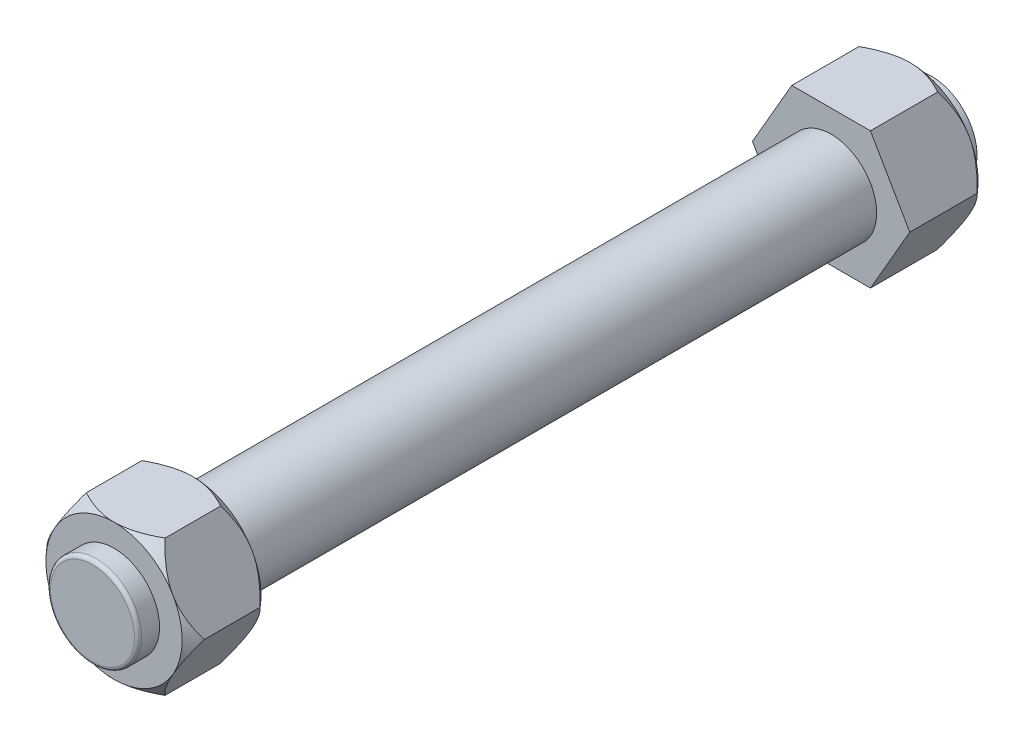
from build123d import *

# Parameters (mm, degrees)
CROQUIS1_R              = 6.35
SALIENTE_EXTRUIR1_DEPTH = 117
CROQUIS2_R              = 6.35
SALIENTE_EXTRUIR2_DEPTH = 14
CROQUIS3_R              = 6.35
CORTAR_EXTRUIR1_DEPTH   = 3
CROQUIS4_R              = 25.644678888
CROQUIS4_R_2            = 9.5
CORTAR_EXTRUIR2_DEPTH   = 10
CORTAR_EXTRUIR2_DRAFT   = -42
CROQUIS5_R              = 21.393004687
CROQUIS5_R_2            = 9.5
CORTAR_EXTRUIR3_DEPTH   = 10
CORTAR_EXTRUIR3_DRAFT   = -42
SALIENTE_EXTRUIR3_DEPTH = 14
CORTAR_EXTRUIR4_START   = -3
CROQUIS7_R              = 6.35
CORTAR_EXTRUIR4_DEPTH   = 3
CROQUIS9_R              = 21.176137587
CROQUIS9_R_2            = 9.5
CORTAR_EXTRUIR5_DEPTH   = 3
CORTAR_EXTRUIR5_DRAFT   = -42
REDONDEO1_R             = 0.5


with BuildPart() as part:
    # Croquis1 → Saliente-Extruir1 (new body)
    with BuildSketch(Plane.XY):
        Circle(CROQUIS1_R)
    extrude(amount=-SALIENTE_EXTRUIR1_DEPTH)

    # Croquis2 → Saliente-Extruir2 (add)
    with BuildSketch(Plane.XY):
        Polygon((10.969655115, 0), (5.484827557, 9.5), (-5.484827557, 9.5), (-10.969655115, 0), (-5.484827557, -9.5), (5.484827557, -9.5), align=None)
        Circle(CROQUIS2_R, mode=Mode.SUBTRACT)
    extrude(amount=-SALIENTE_EXTRUIR2_DEPTH)

    # Croquis3 → Cortar-Extruir1 (cut)
    with BuildSketch(Plane.XY):
        Polygon((10.969655115, 0), (5.484827557, 9.5), (-5.484827557, 9.5), (-10.969655115, 0), (-5.484827557, -9.5), (5.484827557, -9.5), align=None)
        Circle(CROQUIS3_R, mode=Mode.SUBTRACT)
    extrude(amount=-CORTAR_EXTRUIR1_DEPTH, mode=Mode.SUBTRACT)


with BuildPart() as cortar_extruir2_tool:
    # Croquis4 → Cortar-Extruir2 (with draft: the straight prism first)
    with BuildSketch(Plane.XY.offset(-3)):
        Circle(CROQUIS4_R)
        Circle(CROQUIS4_R_2, mode=Mode.SUBTRACT)
    extrude(amount=-CORTAR_EXTRUIR2_DEPTH)
    # Cortar-Extruir2: the draft: its side faces are tilted about the plane it starts from
    cortar_extruir2_sides = [cortar_extruir2_tool.faces().sort_by_distance(p)[0] for p in [
        (-25.644678888, 0, -8),
        (-9.5, 0, -8),
    ]]
    draft(cortar_extruir2_sides, Plane.XY.offset(-3), CORTAR_EXTRUIR2_DRAFT)


with BuildPart() as part_1:
    add(part.part)

    # Cortar-Extruir2: cut by cortar_extruir2_tool
    add(cortar_extruir2_tool.part, mode=Mode.SUBTRACT)


with BuildPart() as cortar_extruir3_tool:
    # Croquis5 → Cortar-Extruir3 (with draft: the straight prism first)
    with BuildSketch(Plane(origin=(0, 0, -14), x_dir=(-1, 0, 0), z_dir=(0, 0, -1))):
        Circle(CROQUIS5_R)
        Circle(CROQUIS5_R_2, mode=Mode.SUBTRACT)
    extrude(amount=-CORTAR_EXTRUIR3_DEPTH)
    # Cortar-Extruir3: the draft: its side faces are tilted about the plane it starts from
    cortar_extruir3_sides = [cortar_extruir3_tool.faces().sort_by_distance(p)[0] for p in [
        (21.393004687, 0, -9),
        (9.5, 0, -9),
    ]]
    draft(cortar_extruir3_sides, Plane(origin=(0, 0, -14), x_dir=(-1, 0, 0), z_dir=(0, 0, -1)), CORTAR_EXTRUIR3_DRAFT)


with BuildPart() as part_2:
    add(part_1.part)

    # Cortar-Extruir3: cut by cortar_extruir3_tool
    add(cortar_extruir3_tool.part, mode=Mode.SUBTRACT)

    # Croquis6 → Saliente-Extruir3 (add)
    with BuildSketch(Plane(origin=(0, 0, -117), x_dir=(-1, 0, 0), z_dir=(0, 0, -1))):
        Polygon((10.969655115, 0), (5.484827557, 9.5), (-5.484827557, 9.5), (-10.969655115, 0), (-5.484827557, -9.5), (5.484827557, -9.5), align=None)
    extrude(amount=-SALIENTE_EXTRUIR3_DEPTH)

    # Croquis7 → Cortar-Extruir4 (cut)
    with BuildSketch(Plane(origin=(0, 0, -117), x_dir=(-1, 0, 0), z_dir=(0, 0, -1)).offset(CORTAR_EXTRUIR4_START)):
        Polygon((10.969655115, 0), (5.484827557, 9.5), (-5.484827557, 9.5), (-10.969655115, 0), (-5.484827557, -9.5), (5.484827557, -9.5), align=None)
        with Locations(Location((0, 0, 0), (0, 0, 180))):
            Circle(CROQUIS7_R, mode=Mode.SUBTRACT)
    extrude(amount=CORTAR_EXTRUIR4_DEPTH, mode=Mode.SUBTRACT)


with BuildPart() as cortar_extruir5_tool:
    # Croquis9 → Cortar-Extruir5 (with draft: the straight prism first)
    with BuildSketch(Plane(origin=(0, 0, -114), x_dir=(-1, 0, 0), z_dir=(0, 0, -1))):
        Circle(CROQUIS9_R)
        Circle(CROQUIS9_R_2, mode=Mode.SUBTRACT)
    extrude(amount=-CORTAR_EXTRUIR5_DEPTH)
    # Cortar-Extruir5: the draft: its side faces are tilted about the plane it starts from
    cortar_extruir5_sides = [cortar_extruir5_tool.faces().sort_by_distance(p)[0] for p in [
        (21.176137587, 0, -112.5),
        (9.5, 0, -112.5),
    ]]
    draft(cortar_extruir5_sides, Plane(origin=(0, 0, -114), x_dir=(-1, 0, 0), z_dir=(0, 0, -1)), CORTAR_EXTRUIR5_DRAFT)


with BuildPart() as part_3:
    add(part_2.part)

    # Cortar-Extruir5: cut by cortar_extruir5_tool
    add(cortar_extruir5_tool.part, mode=Mode.SUBTRACT)

    # Redondeo1
    redondeo1_edges = [part_3.edges().sort_by_distance(p)[0] for p in [
        (-6.35, 0, 0),
    ]]
    fillet(redondeo1_edges, radius=REDONDEO1_R)


solid = part_3.part
